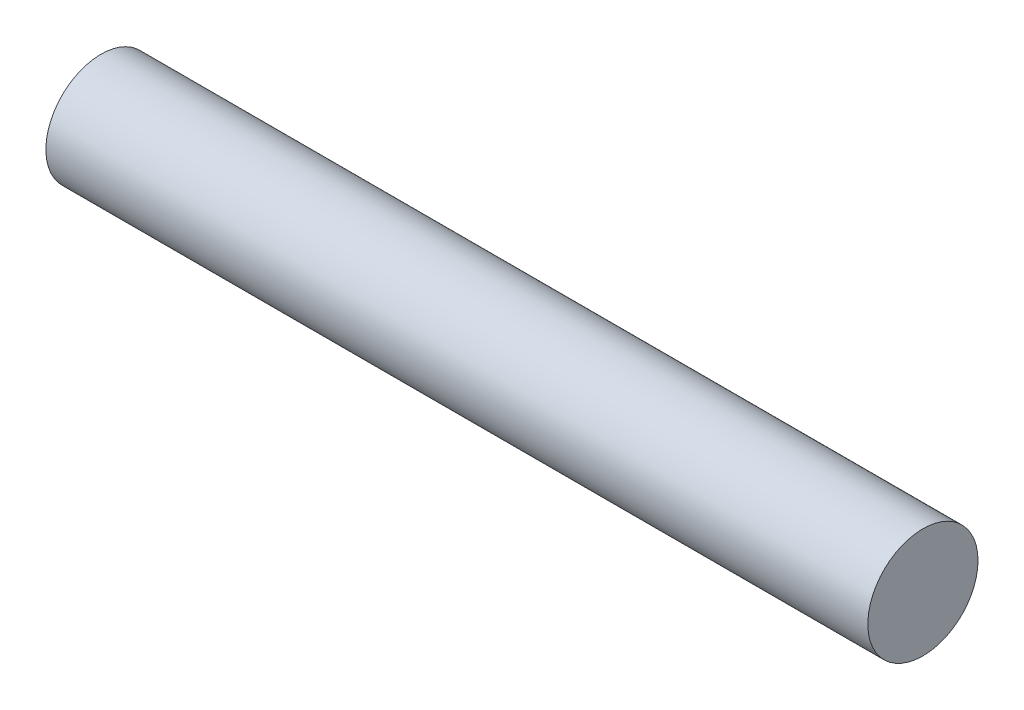
from build123d import *

# Parameters (mm, degrees)
SWEEP1_PROFILE_R = 3.175


with BuildPart() as part:
    # Sweep1: sweep along a curve in space
    with BuildLine() as sweep1_path:
        Line((-69.090499988, 97.75, 219.8250001), (-21.721499996, 97.75, 219.8250001))
    # Sweep1 profile (on start of the path) → Sweep1 (sweep)
    with BuildSketch(Plane(origin=(-69.090499988, 97.75, 219.8250001), x_dir=(0, 0, 1), z_dir=(1, 0, 0))):
        Circle(SWEEP1_PROFILE_R)
    sweep(path=sweep1_path.line)


solid = part.part
